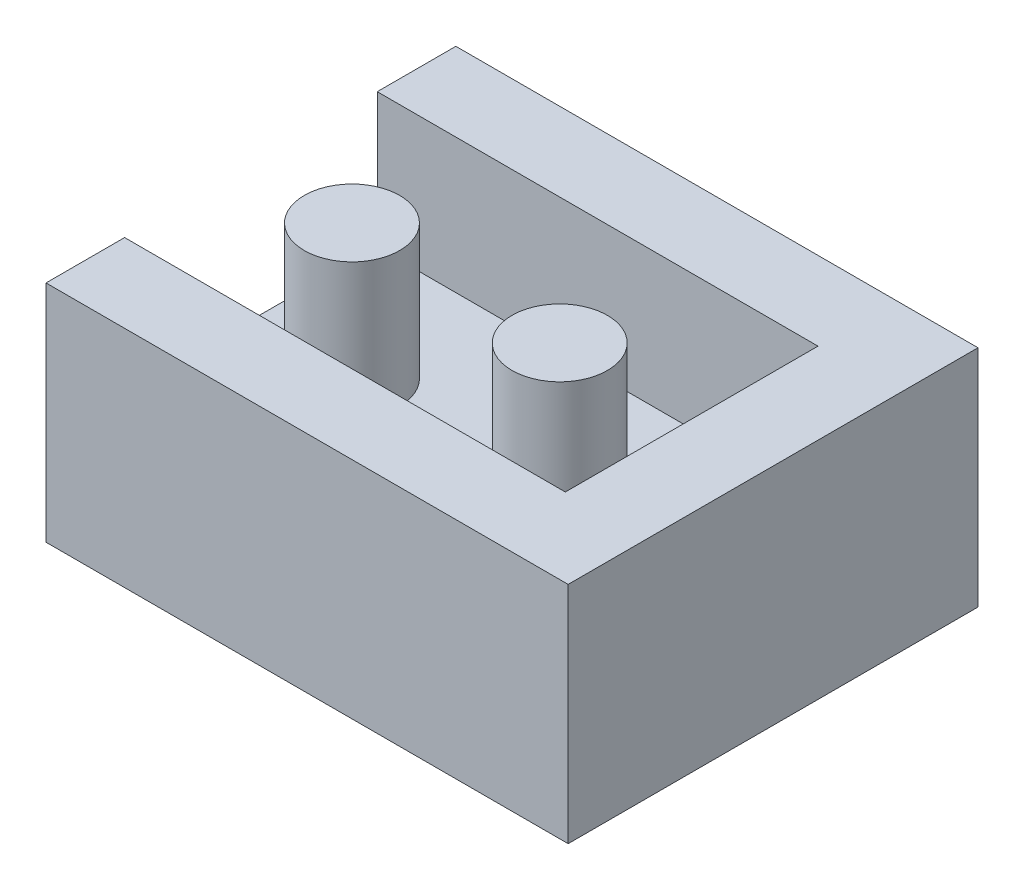
from build123d import *

# Parameters (mm, degrees)
SKETCH1_W           = 15.6
SKETCH1_H           = 14.6
SKETCH1_R           = 1.7
SKETCH1_W_2         = 3
BOSS_EXTRUDE1_DEPTH = 3.2
SKETCH4_W           = 15.7
SKETCH4_H           = 2.8
SKETCH4_R           = 1.7
BOSS_EXTRUDE3_DEPTH = 4.8


with BuildPart() as part:
    # Sketch1 → Boss-Extrude1 (new body)
    # profile 1 of 4: a face of its own
    with BuildSketch(Plane(origin=(0, 0, 0), x_dir=(1, 0, 0), z_dir=(0, 1, 0))):
        with Locations((-1.5, 0)):
            Rectangle(SKETCH1_W, SKETCH1_H)
        with Locations((-5.8, 0)):
            Circle(SKETCH1_R, mode=Mode.SUBTRACT)
        with Locations((1.6, 0)):
            Circle(SKETCH1_R, mode=Mode.SUBTRACT)
    # profile 2 of 4: a face of its own
    with BuildSketch(Plane(origin=(0, 0, 0), x_dir=(1, 0, 0), z_dir=(0, 1, 0))):
        with Locations((7.8, 0)):
            Rectangle(SKETCH1_W_2, SKETCH1_H)
    # profile 3 of 4: a face of its own
    with BuildSketch(Plane(origin=(0, 0, 0), x_dir=(1, 0, 0), z_dir=(0, 1, 0))):
        with Locations((1.6, 0)):
            Circle(SKETCH1_R)
    # profile 4 of 4: a face of its own
    with BuildSketch(Plane(origin=(0, 0, 0), x_dir=(1, 0, 0), z_dir=(0, 1, 0))):
        with Locations((-5.8, 0)):
            Circle(SKETCH1_R)
    extrude(amount=BOSS_EXTRUDE1_DEPTH)

    # Sketch4 → Boss-Extrude3 (add)
    with BuildSketch(Plane(origin=(0, 3.2, 0), x_dir=(1, 0, 0), z_dir=(0, 1, 0))):
        with Locations((-1.45, 5.9)):
            Rectangle(SKETCH4_W, SKETCH4_H)
        Polygon((6.4, -4.5), (6.4, -7.3), (9.3, -7.3), (9.3, 7.3), (6.4, 7.3), (6.4, 4.5), align=None)
        with Locations(Location((-5.7, 0, 0), (0, 0, 270))):
            Circle(SKETCH4_R)
        with Locations(Location((1.7, 0, 0), (0, 0, 270))):
            Circle(SKETCH4_R)
        with Locations((-1.45, -5.9)):
            Rectangle(SKETCH4_W, SKETCH4_H)
    extrude(amount=BOSS_EXTRUDE3_DEPTH)


solid = part.part
